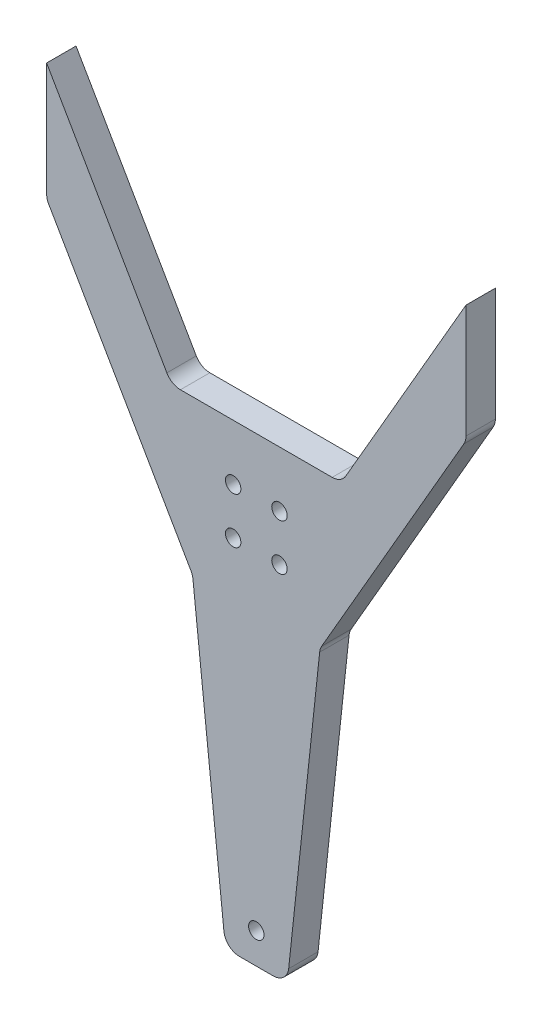
from build123d import *

# Parameters (mm, degrees)
BOSS_EXTRUDE1_DEPTH   = 9.525
FILLET1_R             = 5.08
F_5_0MM_DOWEL_HOLE1_D = 5
SKETCH14_R            = 2.5
CUT_EXTRUDE1_DEPTH    = 139.21913576


with BuildPart() as part:
    # Sketch1 → Boss-Extrude1 (new body)
    with BuildSketch(Plane.XY):
        Polygon((-27.510468203, 50), (27.510468203, 50), (67.924987047, 120), (67.924987047, 81.9), (20.64, 0), (10, -99.432340815), (-10, -99.432340815), (-20.64, 0), (-67.924987047, 81.9), (-67.924987047, 120), align=None)
    extrude(amount=BOSS_EXTRUDE1_DEPTH)

    # Fillet1
    fillet1_edges = [part.edges().sort_by_distance(p)[0] for p in [
        (-27.510468203, 50, 4.7625),
        (27.510468203, 50, 4.7625),
        (67.924987047, 81.9, 4.7625),
        (20.64, 0, 4.7625),
        (10, -99.432340815, 4.7625),
        (-10, -99.432340815, 4.7625),
        (-20.64, 0, 4.7625),
        (-67.924987047, 81.9, 4.7625),
    ]]
    fillet(fillet1_edges, radius=FILLET1_R)

    # Ø5.0mm Dowel Hole1 (through all)
    with Locations(Plane(origin=(0, 0, 0), x_dir=(-1, 0, 0), z_dir=(0, 0, -1))):
        with Locations((-7.5, 31.965654583), (7.5, 31.965654583), (-7.5, 16.965654583), (7.5, 16.965654583)):
            Hole(F_5_0MM_DOWEL_HOLE1_D / 2)

    # Sketch14 → Cut-Extrude1 (cut, through all)
    with BuildSketch(Plane.XY.offset(9.525)):
        with Locations((0, -89.432340815)):
            Circle(SKETCH14_R)
    extrude(amount=-CUT_EXTRUDE1_DEPTH, mode=Mode.SUBTRACT)


solid = part.part
